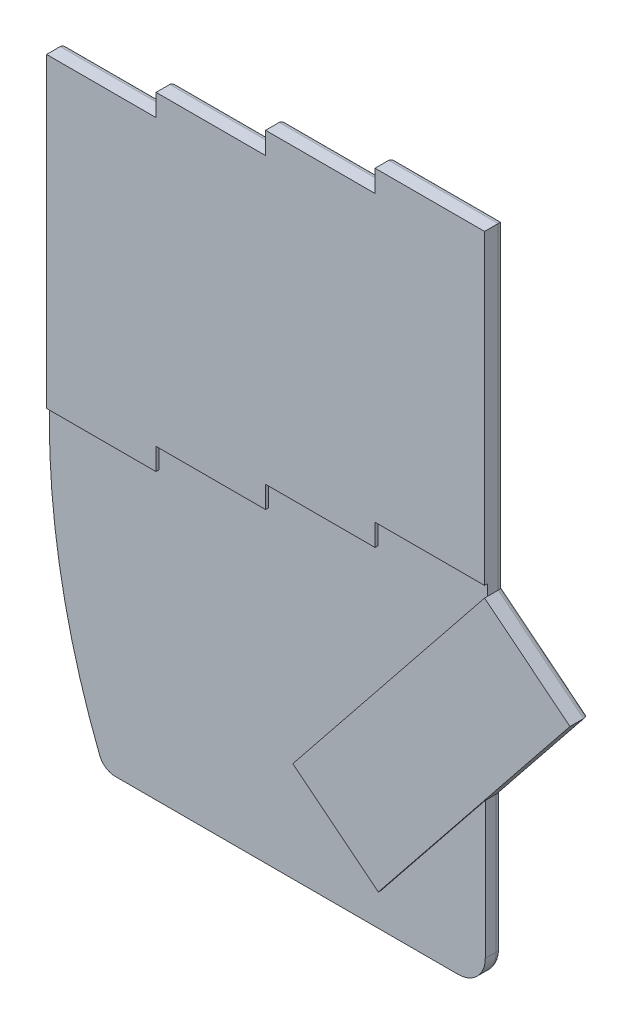
from build123d import *

# Parameters (mm, degrees)
BOSS_EXTRUDE1_DEPTH  = 3
SKETCH2_W            = 20
SKETCH2_H            = 56
BOSS_EXTRUDE2_DEPTH  = 0.5
SKETCH5_W            = 20
SKETCH5_H            = 56
BOSS_EXTRUDE3_DEPTH  = 0.5
SKETCH6_W            = 20
SKETCH6_H            = 56
BOSS_EXTRUDE4_DEPTH  = 0.5
SKETCH7_W            = 20
SKETCH7_H            = 56
BOSS_EXTRUDE5_DEPTH  = 0.5
BOSS_EXTRUDE18_DEPTH = 0.5
FILLET1_R            = 1


with BuildPart() as part:
    # Sketch1 → Boss-Extrude1 (new body)
    with BuildSketch(Plane.XY):
        with BuildLine():
            Line((0.088772672, 50.445513271), (0.088772672, 108.445513271))
            Line((0.088772672, 108.445513271), (20.088772672, 108.445513271))
            Line((20.088772672, 108.445513271), (20.088772672, 112.445513271))
            Line((20.088772672, 112.445513271), (40.088772672, 112.445513271))
            Line((40.088772672, 112.445513271), (40.088772672, 116.445513271))
            Line((40.088772672, 116.445513271), (60.088772672, 116.445513271))
            Line((60.088772672, 116.445513271), (60.088772672, 120.445513271))
            Line((60.088772672, 120.445513271), (80.088772672, 120.445513271))
            Line((80.088772672, 120.445513271), (80.088772672, 62.445513271))
            Line((80.088772672, 62.445513271), (95.696655206, 49.939754486))
            Line((95.696655206, 49.939754486), (79.719999866, 30))
            Line((79.719999866, 30), (79.719999866, 5))
            ThreePointArc((79.719999866, 5), (78.255533771, 1.464466094), (74.719999866, 0))
            Line((74.719999866, 0), (45.081340107, 0))
            Line((45.081340107, 0), (12.090244869, 0))
            ThreePointArc((12.090244869, 0), (10.402431062, 0.519821669), (9.299525382, 1.899143631))
            ThreePointArc((9.299525382, 1.899143631), (2.402932305, 25.737613543), (0.088772672, 50.445513271))
        make_face()
    extrude(amount=-BOSS_EXTRUDE1_DEPTH)

    # Sketch2 → Boss-Extrude2 (add)
    with BuildSketch(Plane.XY):
        with Locations((10.088772672, 80.445513271)):
            Rectangle(SKETCH2_W, SKETCH2_H)
    extrude(amount=BOSS_EXTRUDE2_DEPTH)

    # Sketch5 → Boss-Extrude3 (add)
    with BuildSketch(Plane.XY):
        with Locations((30.088772672, 84.445513271)):
            Rectangle(SKETCH5_W, SKETCH5_H)
    extrude(amount=BOSS_EXTRUDE3_DEPTH)

    # Sketch6 → Boss-Extrude4 (add)
    with BuildSketch(Plane.XY):
        with Locations((50.088772672, 88.445513271)):
            Rectangle(SKETCH6_W, SKETCH6_H)
    extrude(amount=BOSS_EXTRUDE4_DEPTH)

    # Sketch7 → Boss-Extrude5 (add)
    with BuildSketch(Plane.XY):
        with Locations((70.088772672, 92.445513271)):
            Rectangle(SKETCH7_W, SKETCH7_H)
    extrude(amount=BOSS_EXTRUDE5_DEPTH)

    # Sketch10 → Boss-Extrude18 (add)
    with BuildSketch(Plane.XY):
        Polygon((80.088772672, 62.445513271), (95.696655206, 49.939754486), (60.680530606, 6.23768339), (45.072648072, 18.743442176), align=None)
    extrude(amount=BOSS_EXTRUDE18_DEPTH)

    # Fillet1
    fillet1_edges = [part.edges().sort_by_distance(p)[0] for p in [
        (87.892713939, 56.192633878, -3),
        (80.088772672, 91.445513271, -3),
        (70.088772672, 120.445513271, -3),
        (60.088772672, 118.445513271, -3),
        (50.088772672, 116.445513271, -3),
        (40.088772672, 114.445513271, -3),
        (30.088772672, 112.445513271, -3),
        (20.088772672, 110.445513271, -3),
        (10.088772672, 108.445513271, -3),
        (0.088772672, 79.445513271, -3),
        (79.719999866, 17.5, -3),
        (2.402932305, 25.737613543, -3),
        (10.402431062, 0.519821669, -3),
        (43.405122367, 0, -3),
        (78.255533771, 1.464466094, -3),
        (87.708327536, 39.969877243, -3),
    ]]
    fillet(fillet1_edges, radius=FILLET1_R)


solid = part.part
